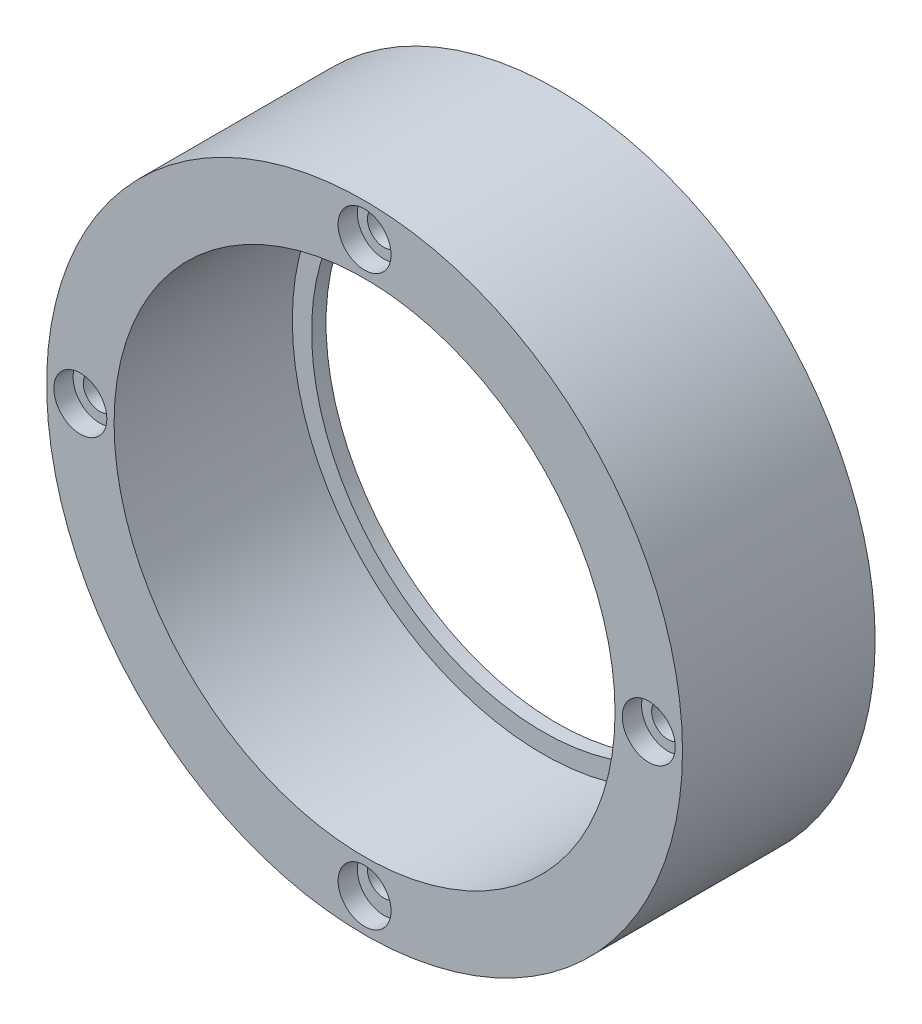
from build123d import *

# Parameters (mm, degrees)
SKETCH1_R           = 33
SKETCH1_R_2         = 24
BOSS_EXTRUDE1_DEPTH = 1.5
SKETCH3_R           = 33
SKETCH3_R_2         = 26
BOSS_EXTRUDE2_DEPTH = 18.5
SKETCH4_R           = 1.7
CUT_EXTRUDE1_DEPTH  = 51.774009099
SKETCH5_R           = 2.75
CUT_EXTRUDE2_DEPTH  = 2


with BuildPart() as part:
    # Sketch1 → Boss-Extrude1 (new body)
    with BuildSketch(Plane.XY):
        Circle(SKETCH1_R)
        Circle(SKETCH1_R_2, mode=Mode.SUBTRACT)
    extrude(amount=BOSS_EXTRUDE1_DEPTH)

    # Sketch3 → Boss-Extrude2 (add)
    with BuildSketch(Plane.XY.offset(1.5)):
        Circle(SKETCH3_R)
        Circle(SKETCH3_R_2, mode=Mode.SUBTRACT)
    extrude(amount=BOSS_EXTRUDE2_DEPTH)

    # Sketch4 → Cut-Extrude1 (cut, through all)
    with BuildSketch(Plane.XY.offset(20)):
        with Locations((0, 29.5)):
            Circle(SKETCH4_R)
        with Locations((29.5, 0)):
            Circle(SKETCH4_R)
        with Locations((0, -29)):
            Circle(SKETCH4_R)
        with Locations((-29.5, 0)):
            Circle(SKETCH4_R)
    extrude(amount=-CUT_EXTRUDE1_DEPTH, mode=Mode.SUBTRACT)

    # Sketch5 → Cut-Extrude2 (cut)
    with BuildSketch(Plane.XY.offset(20)):
        with Locations((0, 29.5)):
            Circle(SKETCH5_R)
        with Locations((29.5, 0)):
            Circle(SKETCH5_R)
        with Locations((0, -29.5)):
            Circle(SKETCH5_R)
        with Locations((-29.5, 0)):
            Circle(SKETCH5_R)
    extrude(amount=-CUT_EXTRUDE2_DEPTH, mode=Mode.SUBTRACT)


solid = part.part
